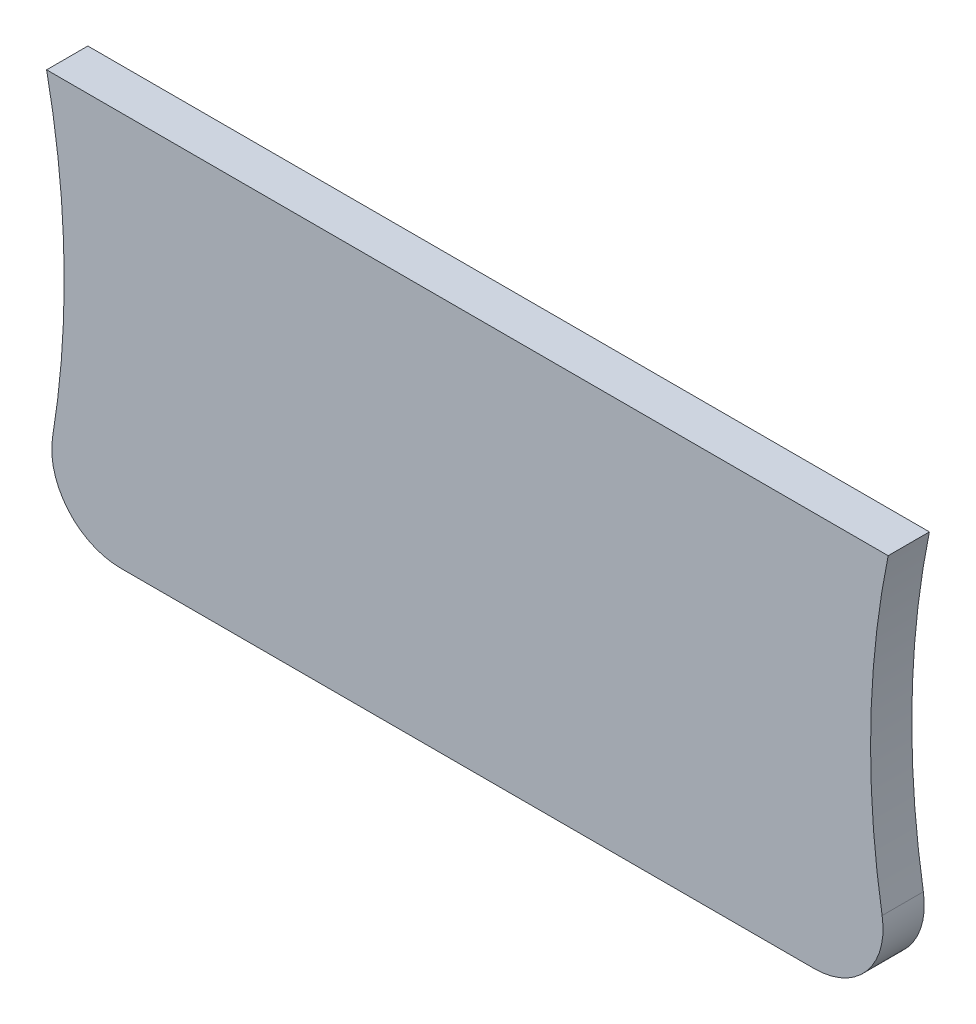
from build123d import *

# Parameters (mm, degrees)
EXTRUDE_1_DEPTH = 3


with BuildPart() as part:
    # 草图2 → 凸台-拉伸1 (new body)
    with BuildSketch(Plane.XY):
        with BuildLine():
            Line((-96.503576656, -60.881642549), (-46.010126781, -60.881642549))
            ThreePointArc((-46.010126781, -60.881642549), (-42.197526053, -59.116464908), (-41.076892349, -55.067272827))
            ThreePointArc((-41.076892349, -55.067272827), (-41.906542012, -43.597485837), (-40.637461679, -32.167972843))
            Line((-40.637461679, -32.167972843), (-101.876241757, -32.167972843))
            ThreePointArc((-101.876241757, -32.167972843), (-100.607161424, -43.597485837), (-101.436811087, -55.067272827))
            ThreePointArc((-101.436811087, -55.067272827), (-100.316177383, -59.116464908), (-96.503576656, -60.881642549))
        make_face()
    extrude(amount=EXTRUDE_1_DEPTH)


solid = part.part
